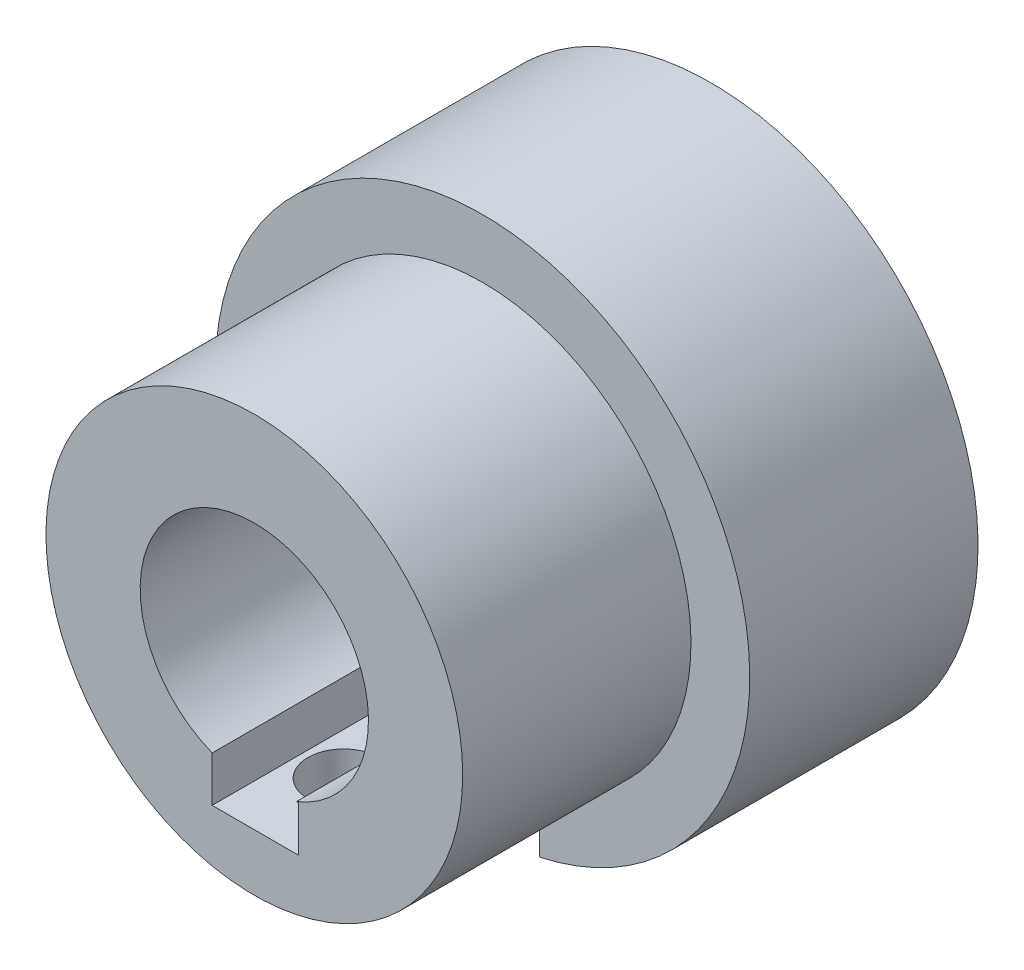
from build123d import *

# Parameters (mm, degrees)
SALIENTE_EXTRUIR1_DEPTH = 20
CROQUIS2_R              = 18.253461236
SALIENTE_EXTRUIR2_DEPTH = 20
CROQUIS3_R              = 10
CROQUIS3_W              = 7.547979368
CROQUIS3_H              = 3.978601063
CORTAR_EXTRUIR1_DEPTH   = 20
CROQUIS4_R              = 3.130594147
CORTAR_EXTRUIR2_DEPTH   = 20


with BuildPart() as part:
    # Croquis1 → Saliente-Extruir1 (new body)
    with BuildSketch(Plane.XY):
        with BuildLine():
            Line((-5, -22.8595713), (-5, -3.514210375))
            Line((-5, -3.514210375), (5, -3.514210375))
            Line((5, -3.514210375), (5, -22.8595713))
            ThreePointArc((5, -22.8595713), (18.228549037, -14.672423113), (23.4, 0))
            ThreePointArc((23.4, 0), (-14.672423113, 18.228549037), (-5, -22.8595713))
        make_face()
    extrude(amount=SALIENTE_EXTRUIR1_DEPTH)

    # Croquis2 → Saliente-Extruir2 (add)
    with BuildSketch(Plane.XY.offset(20)):
        with Locations(Location((0, 0, 0), (0, 0, 254.102297609))):
            Circle(CROQUIS2_R)
    extrude(amount=SALIENTE_EXTRUIR2_DEPTH)

    # Croquis3 → Cortar-Extruir1 (cut)
    with BuildSketch(Plane.XY.offset(40)):
        Circle(CROQUIS3_R)
        with Locations((0.081314891, -11.282532094)):
            Rectangle(CROQUIS3_W, CROQUIS3_H)
    extrude(amount=-CORTAR_EXTRUIR1_DEPTH, mode=Mode.SUBTRACT)

    # Croquis4 → Cortar-Extruir2 (cut)
    with BuildSketch(Plane(origin=(0, 0, 0), x_dir=(1, 0, 0), z_dir=(0, 1, 0))):
        with Locations(Location((0, -32.173004338, 0), (0, 0, 270))):
            Circle(CROQUIS4_R)
    extrude(amount=-CORTAR_EXTRUIR2_DEPTH, mode=Mode.SUBTRACT)


solid = part.part
